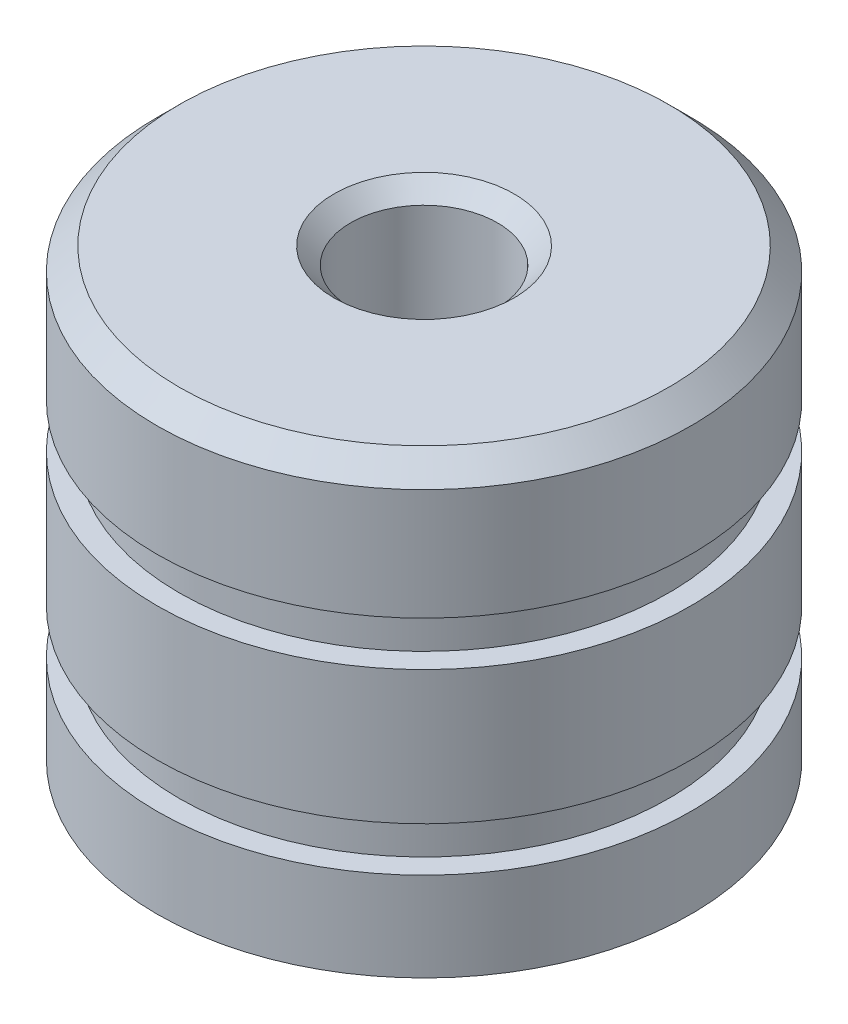
from build123d import *

# Parameters (mm, degrees)
SKETCH2_R                   = 6
BOSS_EXTRUDE1_DEPTH         = 5
CHAMFER1_SIZE               = 0.5
SKETCH3_W                   = 0.5
SKETCH3_H                   = 1
M4_TAPPED_HOLE1_D           = 3.3
M4_TAPPED_HOLE1_DEPTH       = 8
M4_TAPPED_HOLE1_CSINK_D     = 4.05
M4_TAPPED_HOLE1_CSINK_ANGLE = 90
M4_TAPPED_HOLE1_TIP         = 0.991420021


with BuildPart() as part:
    # Sketch2 → Boss-Extrude1 (new, symmetric)
    with BuildSketch(Plane(origin=(0, 0, 0), x_dir=(1, 0, 0), z_dir=(0, 1, 0))):
        with Locations(Location((0, 0, 0), (0, 0, 270))):
            Circle(SKETCH2_R)
    extrude(amount=BOSS_EXTRUDE1_DEPTH, both=True)

    # Chamfer1
    chamfer1_edges = [part.edges().sort_by_distance(p)[0] for p in [
        (0, 5, -6),
    ]]
    chamfer(chamfer1_edges, length=CHAMFER1_SIZE)

    # Sketch3 → Cut-Revolve1 (revolve, cut)
    with BuildSketch(Plane(origin=(0, 0, 0), x_dir=(0, 0, -1), z_dir=(1, 0, 0)), mode=Mode.PRIVATE) as cut_revolve1_sk:
        with Locations((5.75, 1.5)):
            Rectangle(SKETCH3_W, SKETCH3_H)
        with Locations((5.75, -2.5)):
            Rectangle(SKETCH3_W, SKETCH3_H)
    revolve(cut_revolve1_sk.sketch.rotate(Axis((0, 8.15052997, 0), (0, -1, 0)), 180), axis=Axis((0, 8.15052997, 0), (0, -1, 0)), mode=Mode.SUBTRACT)

    # M4 Tapped Hole1
    with Locations(Plane(origin=(0, 5, 0), x_dir=(1, 0, 0), z_dir=(0, 1, 0))):
        with Locations((0, 0)):
            CounterSinkHole(M4_TAPPED_HOLE1_D / 2, M4_TAPPED_HOLE1_CSINK_D / 2, depth=M4_TAPPED_HOLE1_DEPTH, counter_sink_angle=M4_TAPPED_HOLE1_CSINK_ANGLE)
            with Locations((0, 0, -(M4_TAPPED_HOLE1_DEPTH + M4_TAPPED_HOLE1_TIP / 2))):  # 118° drill point
                Cone(0, M4_TAPPED_HOLE1_D / 2, M4_TAPPED_HOLE1_TIP, mode=Mode.SUBTRACT)


solid = part.part
